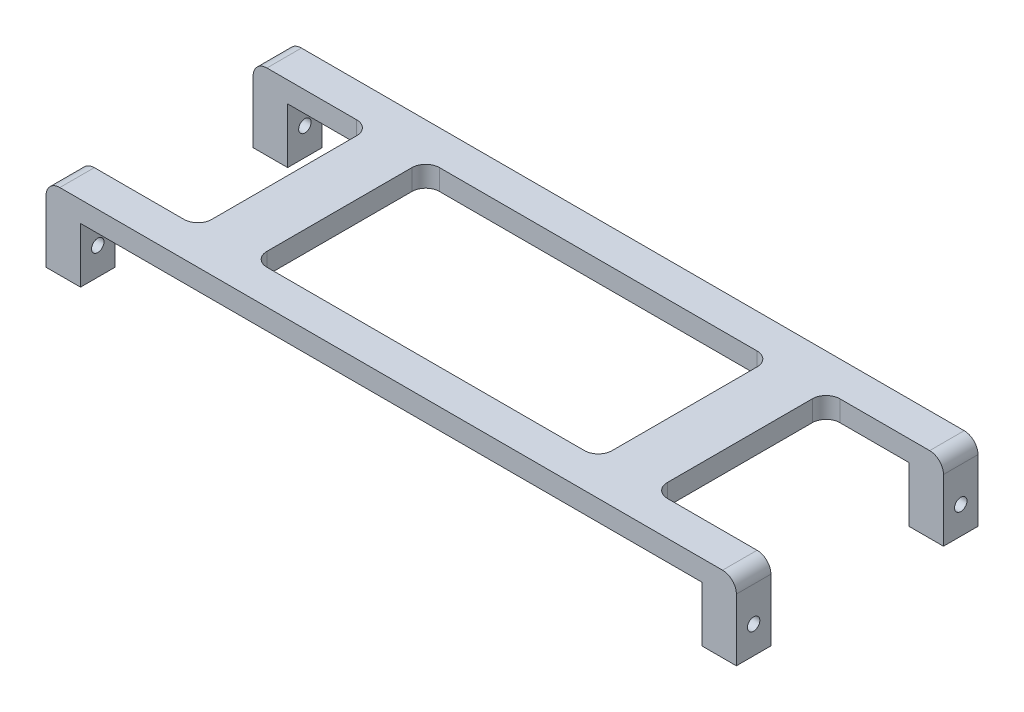
from build123d import *

# Parameters (mm, degrees)
SKETCH_1_W                  = 100
SKETCH_1_H                  = 35
EXTRUDE_1_DEPTH             = 3
SKETCH_2_W                  = 17
SKETCH_2_H                  = 25
CUT_EXTRUDE_1_DEPTH         = 54.058929503
SKETCH_3_W                  = 5
SKETCH_3_H                  = 5
EXTRUDE_2_DEPTH             = 8
SKETCH_4_W                  = 5
SKETCH_4_H                  = 5
EXTRUDE_3_DEPTH             = 8
SKETCH_5_W                  = 17
SKETCH_5_H                  = 30
CUT_EXTRUDE_2_DEPTH         = 54.574714185
SKETCH_6_W                  = 5
SKETCH_6_H                  = 5
EXTRUDE_4_DEPTH             = 8
SKETCH_7_W                  = 5
SKETCH_7_H                  = 3
EXTRUDE_5_DEPTH             = 17
SKETCH_8_W                  = 5
SKETCH_8_H                  = 5
EXTRUDE_6_DEPTH             = 8
SKETCH_9_W                  = 50
SKETCH_9_H                  = 25
CUT_EXTRUDE_3_DEPTH         = 55.104066391
HOLE_WIZARD_1_8_1_8_1_D     = 1.8
HOLE_WIZARD_1_8_1_8_1_DEPTH = 5
HOLE_WIZARD_1_8_1_8_2_D     = 1.8
HOLE_WIZARD_1_8_1_8_2_DEPTH = 100
FILLET_1_R                  = 2


with BuildPart() as part:
    # 草图1 → 凸台-拉伸1 (new body)
    with BuildSketch(Plane.XZ):
        Rectangle(SKETCH_1_W, SKETCH_1_H)
    extrude(amount=-EXTRUDE_1_DEPTH)

    # 草图2 → 切除-拉伸1 (cut, through all)
    with BuildSketch(Plane.XZ):
        with Locations((41.5, 0)):
            Rectangle(SKETCH_2_W, SKETCH_2_H)
    extrude(amount=-CUT_EXTRUDE_1_DEPTH, mode=Mode.SUBTRACT)

    # 草图3 → 凸台-拉伸2 (add)
    with BuildSketch(Plane.XZ):
        with Locations((47.5, -15)):
            Rectangle(SKETCH_3_W, SKETCH_3_H)
    extrude(amount=EXTRUDE_2_DEPTH)

    # 草图4 → 凸台-拉伸3 (add)
    with BuildSketch(Plane.XZ):
        with Locations((47.5, 15)):
            Rectangle(SKETCH_4_W, SKETCH_4_H)
    extrude(amount=EXTRUDE_3_DEPTH)

    # 草图5 → 切除-拉伸2 (cut, through all)
    with BuildSketch(Plane.XZ):
        with Locations((-41.5, 2.5)):
            Rectangle(SKETCH_5_W, SKETCH_5_H)
    extrude(amount=-CUT_EXTRUDE_2_DEPTH, mode=Mode.SUBTRACT)

    # 草图6 → 凸台-拉伸4 (add)
    with BuildSketch(Plane.XZ):
        with Locations((-47.5, -15)):
            Rectangle(SKETCH_6_W, SKETCH_6_H)
    extrude(amount=EXTRUDE_4_DEPTH)

    # 草图7 → 凸台-拉伸5 (add)
    with BuildSketch(Plane.ZY.offset(33)):
        with Locations((15, 1.5)):
            Rectangle(SKETCH_7_W, SKETCH_7_H)
    extrude(amount=EXTRUDE_5_DEPTH)

    # 草图8 → 凸台-拉伸6 (add)
    with BuildSketch(Plane.XZ):
        with Locations((-47.5, 15)):
            Rectangle(SKETCH_8_W, SKETCH_8_H)
    extrude(amount=EXTRUDE_6_DEPTH)

    # 草图9 → 切除-拉伸3 (cut, through all)
    with BuildSketch(Plane(origin=(0, 3, 0), x_dir=(-1, 0, 0), z_dir=(0, 1, 0))):
        Rectangle(SKETCH_9_W, SKETCH_9_H)
    extrude(amount=-CUT_EXTRUDE_3_DEPTH, mode=Mode.SUBTRACT)

    # Ø1.8 (1.8) 直径孔1
    with Locations(Plane.ZY.offset(50)):
        with Locations((15, -4), (-15, -4)):
            Hole(HOLE_WIZARD_1_8_1_8_1_D / 2, depth=HOLE_WIZARD_1_8_1_8_1_DEPTH)

    # Ø1.8 (1.8) 直径孔2
    with Locations(Plane(origin=(50, 0, 0), x_dir=(0, 0, -1), z_dir=(1, 0, 0))):
        with Locations((15, -4), (-15, -4)):
            Hole(HOLE_WIZARD_1_8_1_8_2_D / 2, depth=HOLE_WIZARD_1_8_1_8_2_DEPTH)

    # 圆角1
    fillet_1_edges = [part.edges().sort_by_distance(p)[0] for p in [
        (-25, 1.5, -12.5),
        (25, 1.5, -12.5),
        (25, 1.5, 12.5),
        (-25, 1.5, 12.5),
        (50, 3, 15),
        (33, 1.5, -12.5),
        (33, 1.5, 12.5),
        (50, 3, -15),
        (-50, 3, -15),
        (-33, 1.5, -12.5),
        (-33, 1.5, 12.5),
        (-50, 3, 15),
    ]]
    fillet(fillet_1_edges, radius=FILLET_1_R)


solid = part.part
